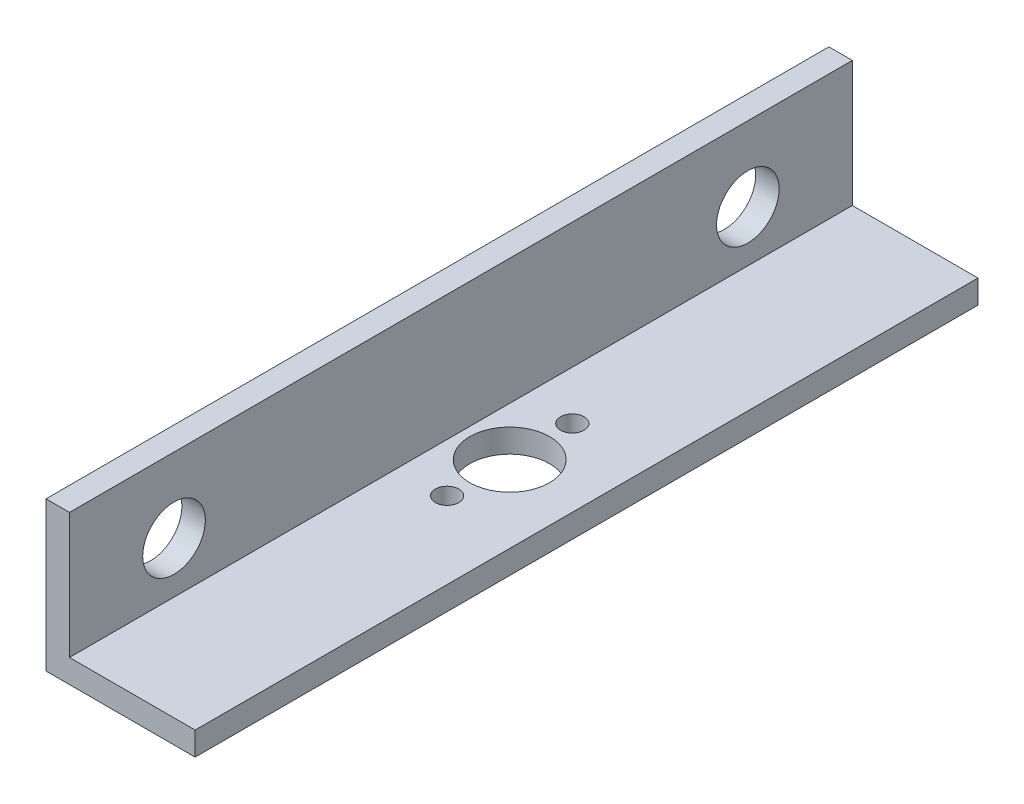
from build123d import *

# Parameters (mm, degrees)
EXTRUDE_THIN1_DEPTH = 50
CUT_EXTRUDE2_REACH  = 58.796
SKETCH4_R           = 4
SKETCH3_R           = 5.1
SKETCH3_R_2         = 1.5
CUT_EXTRUDE1_DEPTH  = 3


with BuildPart() as part:
    # Sketch1 → Extrude-Thin1 (new, symmetric)
    with BuildSketch(Plane.XY):
        Polygon((19.05, 0), (0, 0), (0, 19.05), (3, 19.05), (3, 3), (19.05, 3), align=None)
    extrude(amount=EXTRUDE_THIN1_DEPTH, both=True)

    # Sketch4 → Cut-Extrude2 (cut, up to next)
    with BuildSketch(Plane.ZY, mode=Mode.PRIVATE) as cut_extrude2_sk1:
        with Locations((-36.65, 9.525)):
            Circle(SKETCH4_R)
    cut_extrude2_tool1 = extrude(cut_extrude2_sk1.sketch, amount=-CUT_EXTRUDE2_REACH, mode=Mode.PRIVATE) & part.part
    # Sketch4 → Cut-Extrude2 (cut, up to next)
    with BuildSketch(Plane.ZY, mode=Mode.PRIVATE) as cut_extrude2_sk2:
        with Locations((36.65, 9.525)):
            Circle(SKETCH4_R)
    cut_extrude2_tool2 = extrude(cut_extrude2_sk2.sketch, amount=-CUT_EXTRUDE2_REACH, mode=Mode.PRIVATE) & part.part
    add(cut_extrude2_tool1.solids().sort_by_distance((0, 9.525, -36.65))[0], mode=Mode.SUBTRACT)
    add(cut_extrude2_tool2.solids().sort_by_distance((0, 9.525, 36.65))[0], mode=Mode.SUBTRACT)

    # Sketch3 → Cut-Extrude1 (cut)
    with BuildSketch(Plane.XZ):
        with Locations(Location((9.23, 0, 0), (0, 0, 270))):
            Circle(SKETCH3_R)
        with Locations(Location((9.23, -8, 0), (0, 0, 270))):
            Circle(SKETCH3_R_2)
        with Locations(Location((9.23, 8, 0), (0, 0, 270))):
            Circle(SKETCH3_R_2)
    extrude(amount=-CUT_EXTRUDE1_DEPTH, mode=Mode.SUBTRACT)


solid = part.part
